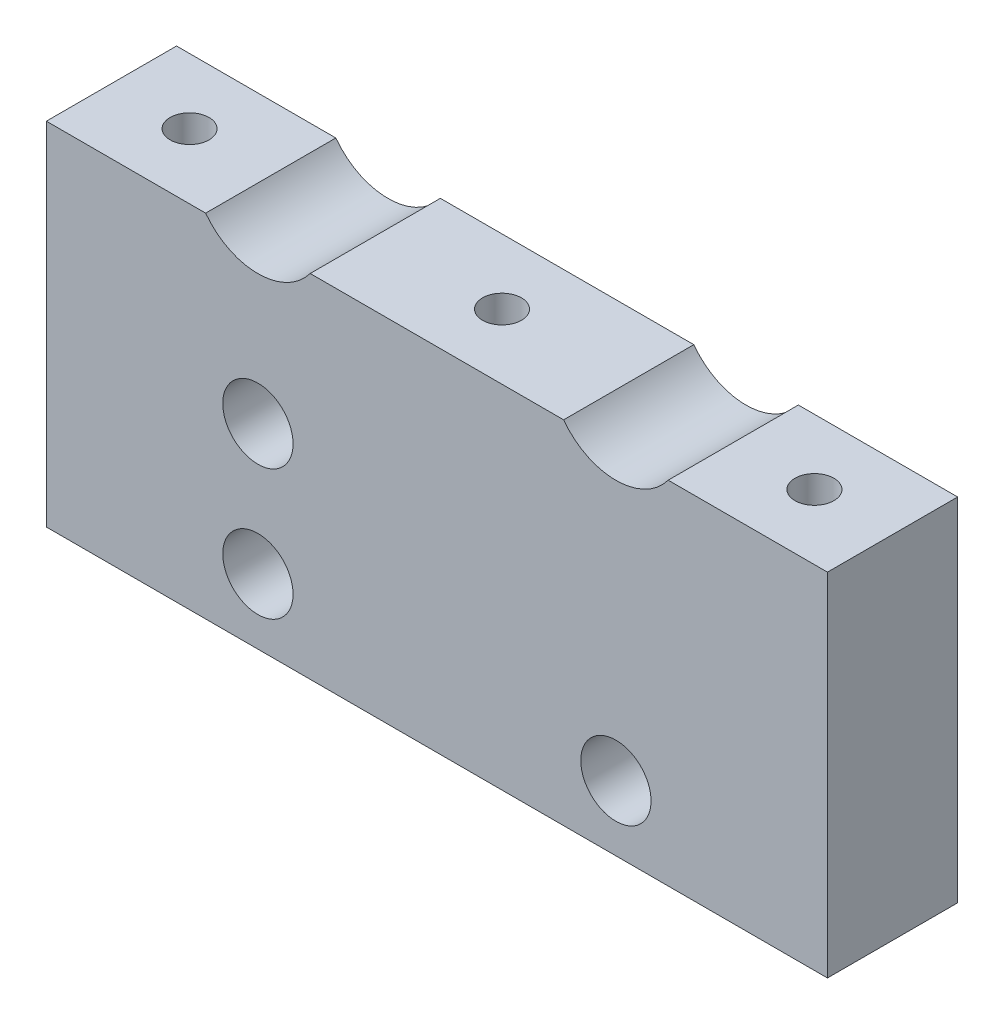
from build123d import *

# Parameters (mm, degrees)
SKETCH1_R                  = 3.429
BOSS_EXTRUDE1_DEPTH        = 12.7
F_10_24_TAPPED_HOLE1_D     = 3.7973
F_10_24_TAPPED_HOLE1_DEPTH = 19.05
F_10_24_TAPPED_HOLE1_TIP   = 1.140824014


with BuildPart() as part:
    # Sketch1 → Boss-Extrude1 (new body)
    with BuildSketch(Plane.XY):
        with BuildLine():
            Line((-38.1, -17.145), (38.1, -17.145))
            Line((38.1, -17.145), (38.1, 17.145))
            Line((38.1, 17.145), (22.561451151, 17.145))
            ThreePointArc((22.561451151, 17.145), (17.4625, 14.5796), (12.363548849, 17.145))
            Line((12.363548849, 17.145), (-12.363548849, 17.145))
            ThreePointArc((-12.363548849, 17.145), (-17.4625, 14.5796), (-22.561451151, 17.145))
            Line((-22.561451151, 17.145), (-38.1, 17.145))
            Line((-38.1, 17.145), (-38.1, -17.145))
        make_face()
        with Locations((-17.4625, -10.795)):
            Circle(SKETCH1_R, mode=Mode.SUBTRACT)
        with Locations(Location((17.4625, -10.795, 0), (0, 0, 180))):
            Circle(SKETCH1_R, mode=Mode.SUBTRACT)
        with Locations((-17.4625, 1.905)):
            Circle(SKETCH1_R, mode=Mode.SUBTRACT)
    extrude(amount=BOSS_EXTRUDE1_DEPTH)

    # #10-24 Tapped Hole1
    with Locations(Plane(origin=(0, 17.145, 0), x_dir=(1, 0, 0), z_dir=(0, 1, 0))):
        with Locations((30.48, -6.35), (-30.48, -6.35), (0, -6.35)):
            Hole(F_10_24_TAPPED_HOLE1_D / 2, depth=F_10_24_TAPPED_HOLE1_DEPTH)
            with Locations((0, 0, -(F_10_24_TAPPED_HOLE1_DEPTH + F_10_24_TAPPED_HOLE1_TIP / 2))):  # 118° drill point
                Cone(0, F_10_24_TAPPED_HOLE1_D / 2, F_10_24_TAPPED_HOLE1_TIP, mode=Mode.SUBTRACT)


solid = part.part
